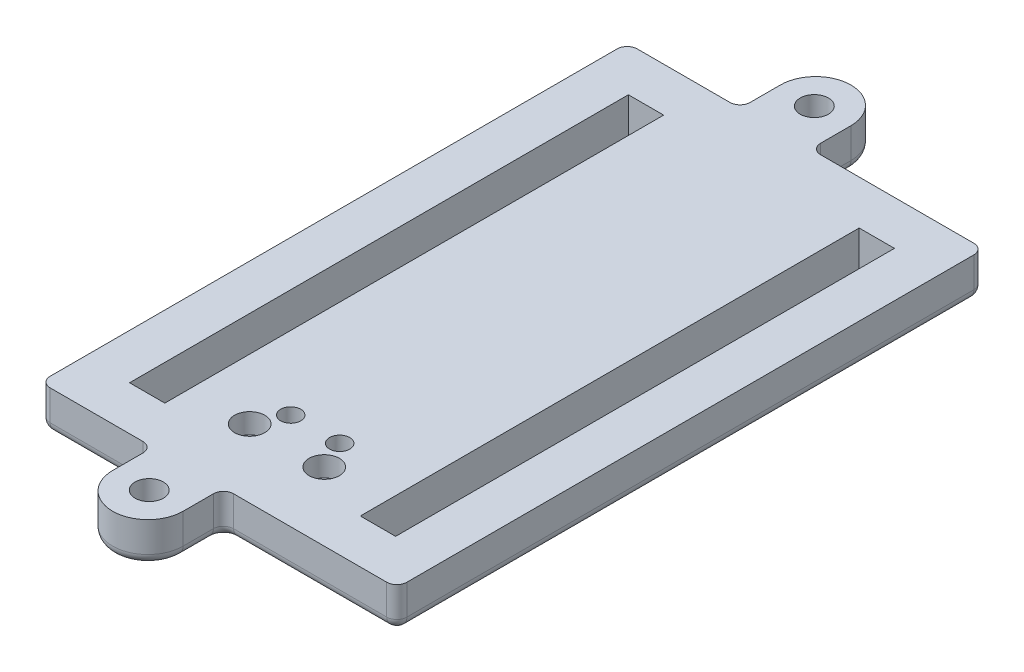
from build123d import *

# Parameters (mm, degrees)
SKETCH1_W            = 35.4
SKETCH1_H            = 58.26
SKETCH1_W_2          = 3.5
SKETCH1_H_2          = 49.5
BASE_DEPTH           = 4
SKETCH2_R            = 1.4
MOUNTING_ENDS_DEPTH  = 4
TOP_START            = -4
SKETCH3_R            = 1.5
SKETCH3_R_2          = 1
TOP_CUTOUTS_DEPTH    = 2
F_1MM_EDGE_FILLETS_R = 1


with BuildPart() as part:
    # Sketch1 → Base (new body)
    with BuildSketch(Plane(origin=(0, 0, 0), x_dir=(1, 0, 0), z_dir=(0, 1, 0))):
        Rectangle(SKETCH1_W, SKETCH1_H)
        with Locations((-11.45, 0)):
            Rectangle(SKETCH1_W_2, SKETCH1_H_2, mode=Mode.SUBTRACT)
        with Locations((11.45, 0)):
            Rectangle(SKETCH1_W_2, SKETCH1_H_2, mode=Mode.SUBTRACT)
    extrude(amount=BASE_DEPTH)

    # Sketch2 → Mounting Ends (add)
    # profile 1 of 2: a face of its own
    with BuildSketch(Plane(origin=(0, 0, 0), x_dir=(1, 0, 0), z_dir=(0, 1, 0))):
        with BuildLine():
            Line((-6.5, 29.13), (0.5, 29.13))
            Line((0.5, 29.13), (0.5, 33.13))
            ThreePointArc((0.5, 33.13), (-3, 36.63), (-6.5, 33.13))
            Line((-6.5, 33.13), (-6.5, 29.13))
        make_face()
        with Locations(Location((-3, 33, 0), (0, 0, 270))):
            Circle(SKETCH2_R, mode=Mode.SUBTRACT)
    # profile 2 of 2: a face of its own
    with BuildSketch(Plane(origin=(0, 0, 0), x_dir=(1, 0, 0), z_dir=(0, 1, 0))):
        with BuildLine():
            Line((-6.5, -29.13), (-6.5, -33.13))
            ThreePointArc((-6.5, -33.13), (-3, -36.63), (0.5, -33.13))
            Line((0.5, -33.13), (0.5, -29.13))
            Line((0.5, -29.13), (-6.5, -29.13))
        make_face()
        with Locations(Location((-3, -33, 0), (0, 0, 90))):
            Circle(SKETCH2_R, mode=Mode.SUBTRACT)
    extrude(amount=MOUNTING_ENDS_DEPTH)

    # Sketch3 → Top Cutouts (cut)
    with BuildSketch(Plane.XZ.offset(TOP_START)):
        with Locations(Location((-3.7, 22.33, 0), (0, 0, 90))):
            Circle(SKETCH3_R)
        with Locations(Location((-2.43, 19.53, 0), (0, 0, 90))):
            Circle(SKETCH3_R_2)
        with Locations(Location((2.43, 19.53, 0), (0, 0, 90))):
            Circle(SKETCH3_R_2)
        with Locations(Location((3.7, 22.33, 0), (0, 0, 90))):
            Circle(SKETCH3_R)
    extrude(amount=TOP_CUTOUTS_DEPTH, mode=Mode.SUBTRACT)

    # 1mm Edge Fillets
    f_1mm_edge_fillets_edges = [part.edges().sort_by_distance(p)[0] for p in [
        (-12.1, 0, -29.13),
        (-3, 0, -36.63),
        (0.5, 2, -29.13),
        (0.5, 0, -31.13),
        (-6.5, 2, -29.13),
        (-6.5, 0, -31.13),
        (-12.1, 0, 29.13),
        (-17.7, 0, 0),
        (9.1, 0, 29.13),
        (9.1, 0, -29.13),
        (-6.5, 2, 29.13),
        (-6.5, 0, 31.13),
        (0.5, 2, 29.13),
        (0.5, 0, 31.13),
        (-3, 0, 36.63),
        (17.7, 0, 0),
        (17.7, 2, 29.13),
        (-17.7, 2, 29.13),
        (-17.7, 2, -29.13),
        (17.7, 2, -29.13),
    ]]
    fillet(f_1mm_edge_fillets_edges, radius=F_1MM_EDGE_FILLETS_R)


solid = part.part
